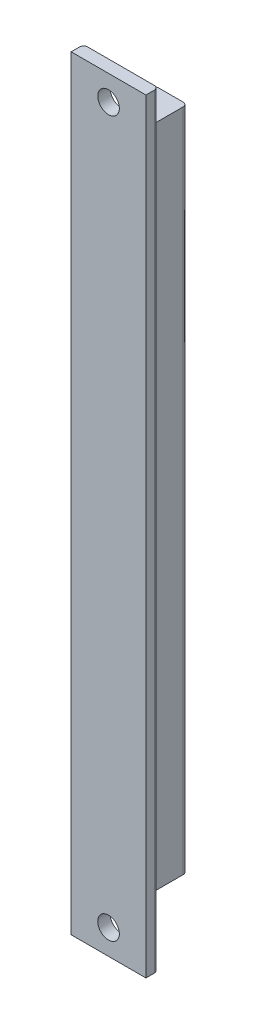
from build123d import *

# Parameters (mm, degrees)
BOSS_EXTRUDE1_DEPTH = 160
BOSS_EXTRUDE2_START = 12
BOSS_EXTRUDE2_DEPTH = 12
BOSS_EXTRUDE3_START = -160
BOSS_EXTRUDE3_DEPTH = 12
SKETCH3_R           = 2.6
CUT_EXTRUDE1_DEPTH  = 12


with BuildPart() as part:
    # Sketch1 → Boss-Extrude1 (new body)
    with BuildSketch(Plane(origin=(0, 0, 0), x_dir=(1, 0, 0), z_dir=(0, 1, 0))):
        with BuildLine():
            Line((0, 2), (-6.1, 2))
            Line((-6.1, 2), (-6.1, 4))
            ThreePointArc((-6.1, 4), (-5.807106781, 4.707106781), (-5.1, 5))
            Line((-5.1, 5), (-1.05, 5))
            Line((-1.05, 5), (-1.05, 16))
            ThreePointArc((-1.05, 16), (-0.757106781, 16.707106781), (-0.05, 17))
            Line((-0.05, 17), (5.85, 17))
            ThreePointArc((5.85, 17), (6.557106781, 16.707106781), (6.85, 16))
            Line((6.85, 16), (6.85, 5))
            Line((6.85, 5), (10.9, 5))
            ThreePointArc((10.9, 5), (11.607106781, 4.707106781), (11.9, 4))
            Line((11.9, 4), (11.9, 2))
            Line((11.9, 2), (0, 2))
        make_face()
    extrude(amount=BOSS_EXTRUDE1_DEPTH)

    # Sketch2 → Boss-Extrude2 (add)
    with BuildSketch(Plane.XZ.offset(BOSS_EXTRUDE2_START)):
        with BuildLine():
            Line((11.9, -2), (-6.1, -2))
            Line((-6.1, -2), (-6.1, -4))
            ThreePointArc((-6.1, -4), (-5.807106781, -4.707106781), (-5.1, -5))
            Line((-5.1, -5), (10.9, -5))
            ThreePointArc((10.9, -5), (11.607106781, -4.707106781), (11.9, -4))
            Line((11.9, -4), (11.9, -2))
        make_face()
    extrude(amount=-BOSS_EXTRUDE2_DEPTH)

    # Sketch2<2> → Boss-Extrude3 (add)
    with BuildSketch(Plane.XZ.offset(BOSS_EXTRUDE3_START)):
        with BuildLine():
            Line((11.9, -2), (-6.1, -2))
            Line((-6.1, -2), (-6.1, -4))
            ThreePointArc((-6.1, -4), (-5.807106781, -4.707106781), (-5.1, -5))
            Line((-5.1, -5), (10.9, -5))
            ThreePointArc((10.9, -5), (11.607106781, -4.707106781), (11.9, -4))
            Line((11.9, -4), (11.9, -2))
        make_face()
    extrude(amount=-BOSS_EXTRUDE3_DEPTH)

    # Sketch3 → Cut-Extrude1 (cut)
    with BuildSketch(Plane(origin=(0, 0, -5), x_dir=(-1, 0, 0), z_dir=(0, 0, -1))):
        with Locations((-2.9, 166)):
            Circle(SKETCH3_R)
        with Locations((-2.9, -6)):
            Circle(SKETCH3_R)
    extrude(amount=-CUT_EXTRUDE1_DEPTH, mode=Mode.SUBTRACT)


solid = part.part
